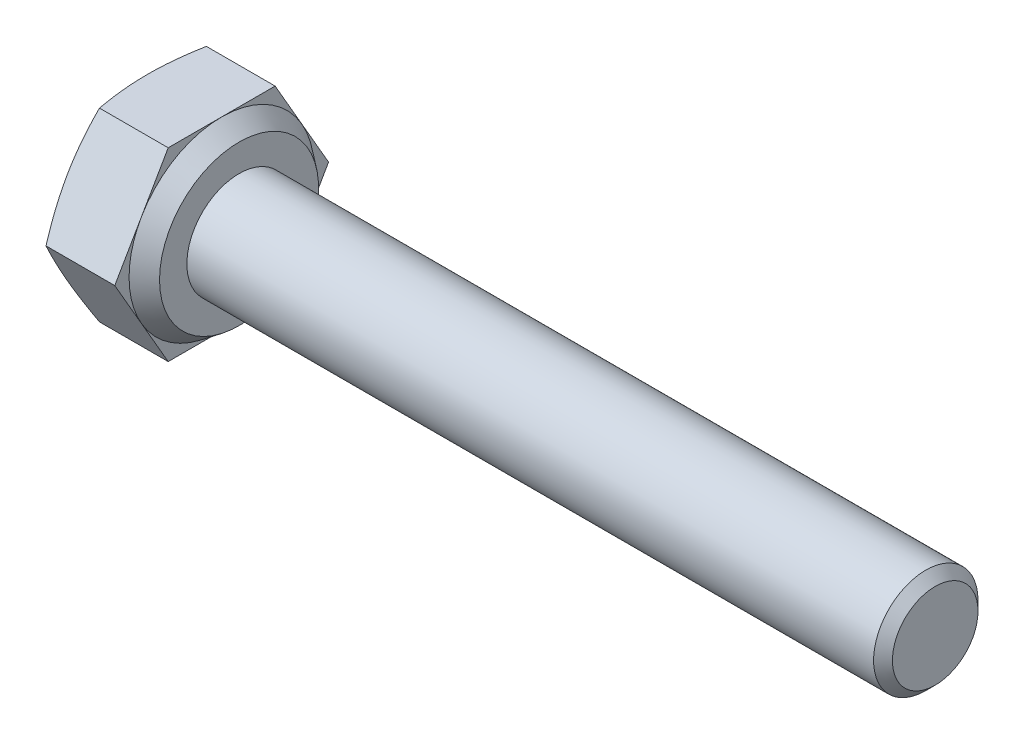
from build123d import *

# Parameters (mm, degrees)
BASEHEAD_DEPTH = 2.125
SKETCH3_R      = 1.5
BASEBODY_DEPTH = 20
CHAMFER1_SIZE  = 0.2705


with BuildPart() as part:
    # Sketch-BaseHead → BaseHead (new body)
    with BuildSketch(Plane(origin=(0, 0, 0), x_dir=(0, 0, -1), z_dir=(1, 0, 0))):
        Polygon((3.071503432, 0), (1.535751716, 2.66), (-1.535751716, 2.66), (-3.071503432, 0), (-1.535751716, -2.66), (1.535751716, -2.66), align=None)
    extrude(amount=BASEHEAD_DEPTH)

    # Sketch4 → HeadChamfer (revolve, cut)
    with BuildSketch(Plane(origin=(-0.264637255, 0, 5.916896391), x_dir=(0, 0, -1), z_dir=(0, 1, 0))):
        Polygon((8.988399823, -0.264637255), (8.576896391, -0.264637255), (8.988399823, -0.414412256), align=None)
    revolve(axis=Axis((-4.001564945, 0, 0), (1, 0, 0)), mode=Mode.SUBTRACT)

    # Sketch1 → Revolve1 (revolve)
    with BuildSketch(Plane.XY, mode=Mode.PRIVATE) as revolve1_sk:
        Polygon((2.125, 0), (2.625, 0), (2.625, -2.285), (2.125, -2.66), align=None)
    revolve(revolve1_sk.sketch.rotate(Axis((-4.001564945, 0, 0), (1, 0, 0)), 270), axis=Axis((-4.001564945, 0, 0), (1, 0, 0)))

    # Sketch3 → BaseBody (add)
    with BuildSketch(Plane(origin=(2.625, 0, 0), x_dir=(0, 0, -1), z_dir=(1, 0, 0))):
        Circle(SKETCH3_R)
    extrude(amount=BASEBODY_DEPTH)

    # Chamfer1
    chamfer1_edges = [part.edges().sort_by_distance(p)[0] for p in [
        (22.625, 0, 1.5),
    ]]
    chamfer(chamfer1_edges, length=CHAMFER1_SIZE)


solid = part.part
